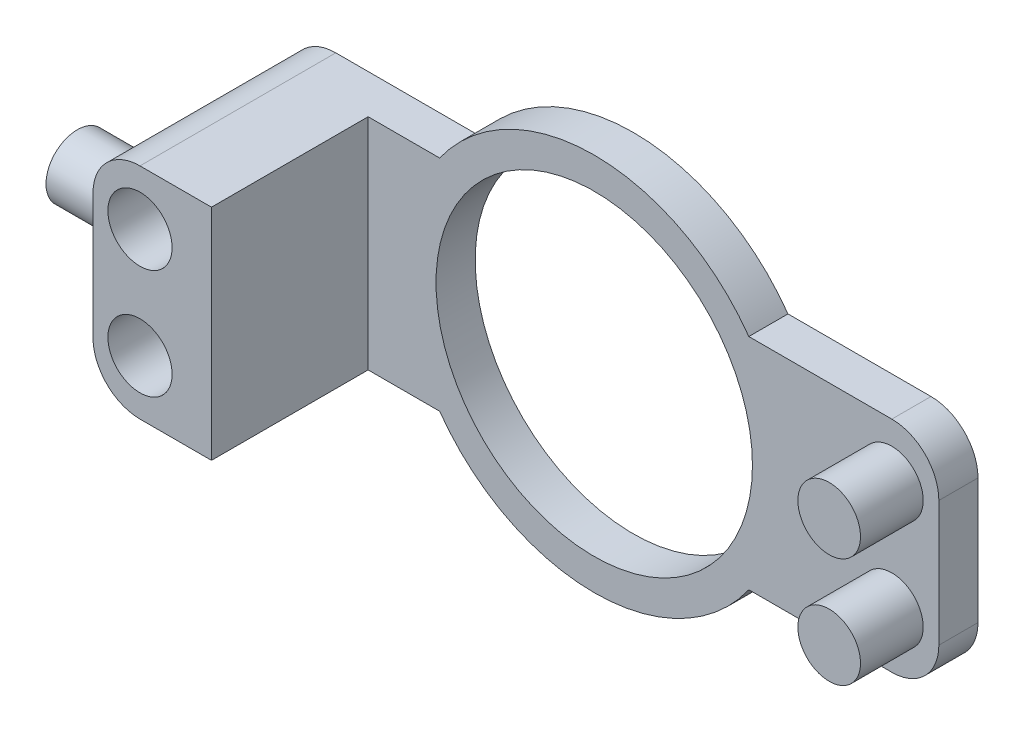
from build123d import *

# Parameters (mm, degrees)
EXTRUDE_1_DEPTH     = 2.5
FILLET_1_R          = 3
EXTRUDE_START       = 10
EXTRUDE_2_DEPTH     = 10
SKETCH_3_R          = 2
EXTRUDE_3_DEPTH     = 6
SKETCH_5_R          = 2
EXTRUDE_4_DEPTH     = 4
SKETCH_6_R          = 2.05
CUT_EXTRUDE_1_DEPTH = 4
FILLET_2_R          = 1


with BuildPart() as part:
    # 草图1 → 凸台-拉伸1 (new body)
    with BuildSketch(Plane.XY):
        with BuildLine():
            ThreePointArc((9.86965045, 7), (0, 12.1), (-9.86965045, 7))
            Line((-9.86965045, 7), (-7.28079666, 7))
            ThreePointArc((-7.28079666, 7), (0, 10.1), (7.28079666, 7))
            Line((7.28079666, 7), (9.86965045, 7))
        make_face()
        with BuildLine():
            Line((-22, 7), (-22, -7))
            Line((-22, -7), (-9.86965045, -7))
            ThreePointArc((-9.86965045, -7), (-12.1, 0), (-9.86965045, 7))
            Line((-9.86965045, 7), (-22, 7))
        make_face()
        with BuildLine():
            ThreePointArc((12.1, 0), (11.528936864, -3.673365593), (9.86965045, -7))
            Line((9.86965045, -7), (22, -7))
            Line((22, -7), (22, 7))
            Line((22, 7), (9.86965045, 7))
            ThreePointArc((9.86965045, 7), (11.528936864, 3.673365593), (12.1, 0))
        make_face()
        with BuildLine():
            Line((-7.28079666, -7), (-9.86965045, -7))
            ThreePointArc((-9.86965045, -7), (0, -12.1), (9.86965045, -7))
            Line((9.86965045, -7), (7.28079666, -7))
            ThreePointArc((7.28079666, -7), (0, -10.1), (-7.28079666, -7))
        make_face()
        with BuildLine():
            ThreePointArc((-9.86965045, 7), (-12.1, 0), (-9.86965045, -7))
            Line((-9.86965045, -7), (-7.28079666, -7))
            ThreePointArc((-7.28079666, -7), (-10.1, 0), (-7.28079666, 7))
            Line((-7.28079666, 7), (-9.86965045, 7))
        make_face()
        with BuildLine():
            Line((7.28079666, -7), (9.86965045, -7))
            ThreePointArc((9.86965045, -7), (11.528936864, -3.673365593), (12.1, 0))
            ThreePointArc((12.1, 0), (11.528936864, 3.673365593), (9.86965045, 7))
            Line((9.86965045, 7), (7.28079666, 7))
            ThreePointArc((7.28079666, 7), (9.368725801, 3.773191867), (10.1, 0))
            ThreePointArc((10.1, 0), (9.368725801, -3.773191867), (7.28079666, -7))
        make_face()
        with BuildLine():
            ThreePointArc((-9.86965045, 7), (-12.1, 0), (-9.86965045, -7))
            Line((-9.86965045, -7), (-7.28079666, -7))
            ThreePointArc((-7.28079666, -7), (-10.1, 0), (-7.28079666, 7))
            Line((-7.28079666, 7), (-9.86965045, 7))
        make_face()
        with BuildLine():
            Line((7.28079666, -7), (9.86965045, -7))
            ThreePointArc((9.86965045, -7), (11.528936864, -3.673365593), (12.1, 0))
            ThreePointArc((12.1, 0), (11.528936864, 3.673365593), (9.86965045, 7))
            Line((9.86965045, 7), (7.28079666, 7))
            ThreePointArc((7.28079666, 7), (9.368725801, 3.773191867), (10.1, 0))
            ThreePointArc((10.1, 0), (9.368725801, -3.773191867), (7.28079666, -7))
        make_face()
    extrude(amount=EXTRUDE_1_DEPTH)

    # 圆角1
    fillet_1_edges = [part.edges().sort_by_distance(p)[0] for p in [
        (22, 7, 1.25),
        (22, -7, 1.25),
        (-22, -7, 1.25),
        (-22, 7, 1.25),
    ]]
    fillet(fillet_1_edges, radius=FILLET_1_R)

    # 草图2 → 凸台-拉伸2 (add)
    with BuildSketch(Plane.XY.offset(2.5).offset(EXTRUDE_START)):
        with BuildLine():
            Line((-14.434825225, -7), (-14.434825225, 7))
            Line((-14.434825225, 7), (-19, 7))
            ThreePointArc((-19, 7), (-21.121320344, 6.121320344), (-22, 4))
            Line((-22, 4), (-22, -4))
            ThreePointArc((-22, -4), (-21.121320344, -6.121320344), (-19, -7))
            Line((-19, -7), (-14.434825225, -7))
        make_face()
    extrude(amount=-EXTRUDE_2_DEPTH)

    # 草图3 → 凸台-拉伸3 (add)
    with BuildSketch(Plane.ZY.offset(22)):
        with Locations(Location((7.5, 0, 0), (0, 0, 270))):
            Circle(SKETCH_3_R)
    extrude(amount=EXTRUDE_3_DEPTH)

    # 草图5 → 凸台-拉伸4 (add)
    with BuildSketch(Plane.XY.offset(2.5)):
        with Locations(Location((19, -3.5, 0), (0, 0, 180))):
            Circle(SKETCH_5_R)
        with Locations(Location((19, 3.5, 0), (0, 0, 180))):
            Circle(SKETCH_5_R)
    extrude(amount=EXTRUDE_4_DEPTH)

    # 草图6 → 切除-拉伸1 (cut)
    with BuildSketch(Plane.XY.offset(12.5)):
        with Locations((-19, 3.5)):
            Circle(SKETCH_6_R)
        with Locations((-19, -3.5)):
            Circle(SKETCH_6_R)
    extrude(amount=-CUT_EXTRUDE_1_DEPTH, mode=Mode.SUBTRACT)

    # 圆角2
    fillet_2_edges = [part.edges().sort_by_distance(p)[0] for p in [
        (-22, 2, 7.5),
    ]]
    fillet(fillet_2_edges, radius=FILLET_2_R)


solid = part.part
